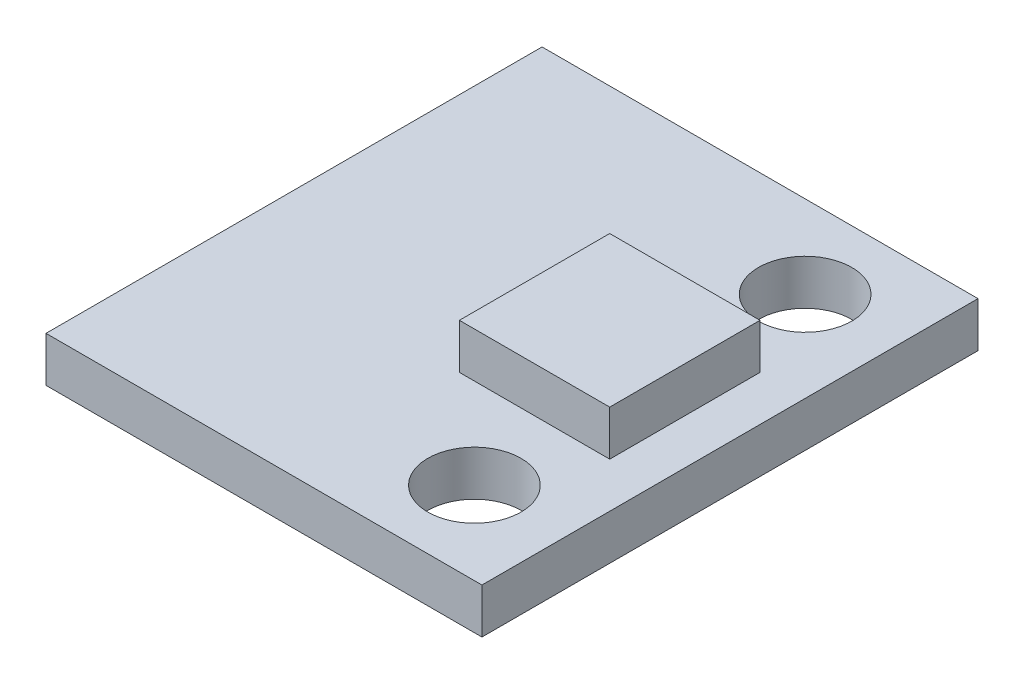
from build123d import *

# Parameters (mm, degrees)
SKETCH1_W           = 14.5
SKETCH1_H           = 16.5
BOSS_EXTRUDE1_DEPTH = 1.5
SKETCH2_R           = 1.55
CUT_EXTRUDE1_DEPTH  = 12.084899639
SKETCH3_W           = 5
SKETCH3_H           = 5
BOSS_EXTRUDE2_DEPTH = 1.5


with BuildPart() as part:
    # Sketch1 → Boss-Extrude1 (new body)
    with BuildSketch(Plane(origin=(0, 0, 0), x_dir=(1, 0, 0), z_dir=(0, 1, 0))):
        Rectangle(SKETCH1_W, SKETCH1_H)
    extrude(amount=BOSS_EXTRUDE1_DEPTH)

    # Sketch2 → Cut-Extrude1 (cut, through all)
    with BuildSketch(Plane(origin=(0, 1.5, 0), x_dir=(1, 0, 0), z_dir=(0, 1, 0))):
        with Locations(Location((4.25, 5.5, 0), (0, 0, 270))):
            Circle(SKETCH2_R)
        with Locations(Location((4.25, -5.5, 0), (0, 0, 90))):
            Circle(SKETCH2_R)
    extrude(amount=-CUT_EXTRUDE1_DEPTH, mode=Mode.SUBTRACT)

    # Sketch3 → Boss-Extrude2 (add)
    with BuildSketch(Plane(origin=(0, 1.5, 0), x_dir=(1, 0, 0), z_dir=(0, 1, 0))):
        with Locations((3.25, 0)):
            Rectangle(SKETCH3_W, SKETCH3_H)
    extrude(amount=BOSS_EXTRUDE2_DEPTH)


solid = part.part
